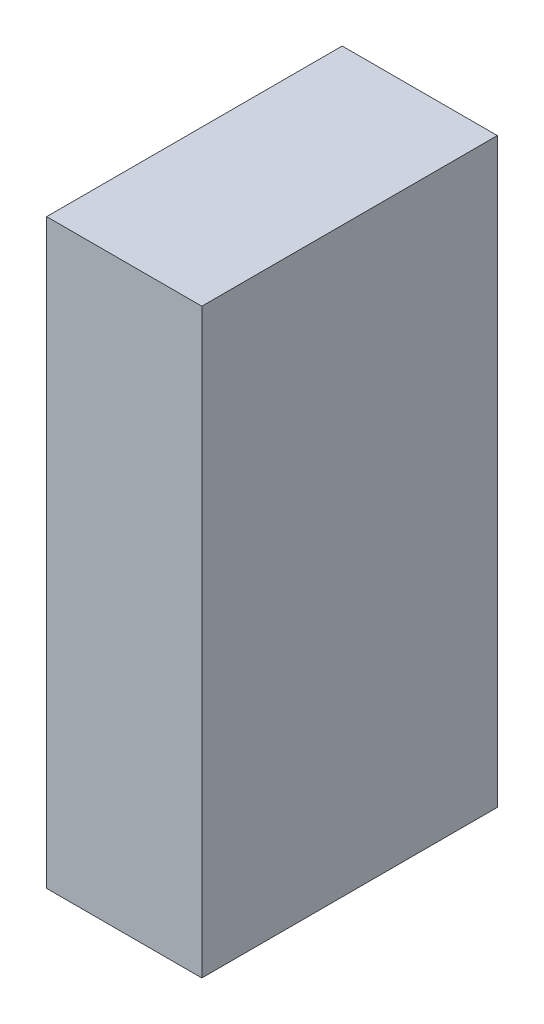
from build123d import *

# Parameters (mm, degrees)
CROQUIS2_W              = 40
CROQUIS2_H              = 76.2
SALIENTE_EXTRUIR1_DEPTH = 150


with BuildPart() as part:
    # Croquis2 → Saliente-Extruir1 (new body)
    with BuildSketch(Plane(origin=(0, 0, 0), x_dir=(1, 0, 0), z_dir=(0, 1, 0))):
        with Locations((20, -38.1)):
            Rectangle(CROQUIS2_W, CROQUIS2_H)
    extrude(amount=SALIENTE_EXTRUIR1_DEPTH)


solid = part.part
